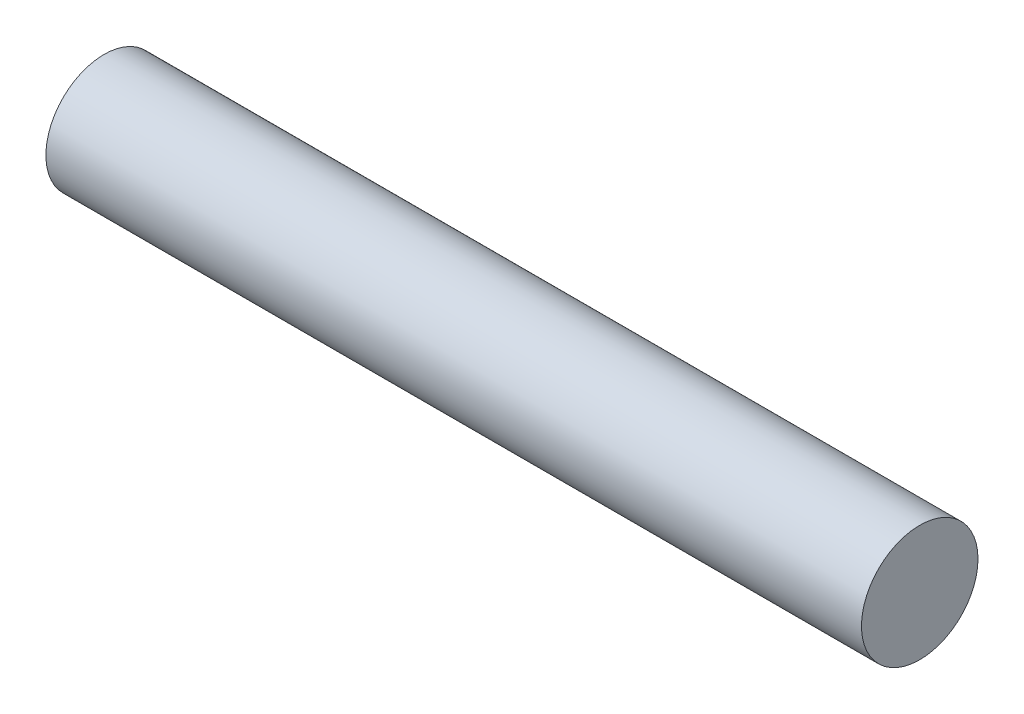
from build123d import *

# Parameters (mm, degrees)
SKETCH1_R           = 7.5
BOSS_EXTRUDE1_DEPTH = 105


with BuildPart() as part:
    # Sketch1 → Boss-Extrude1 (new body)
    with BuildSketch(Plane(origin=(0, 0, 0), x_dir=(0, 0, -1), z_dir=(1, 0, 0))):
        Circle(SKETCH1_R)
    extrude(amount=BOSS_EXTRUDE1_DEPTH)


solid = part.part
